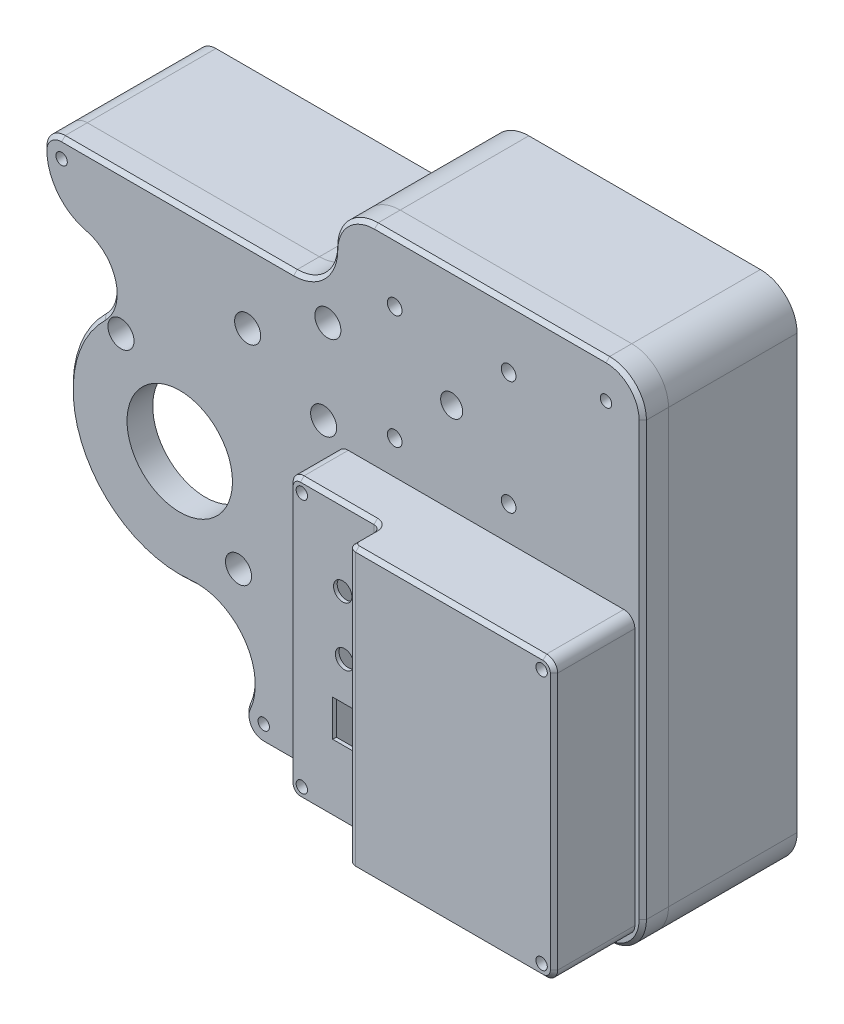
from build123d import *

# Parameters (mm, degrees)
BOSS_EXTRUDE1_DEPTH = 35
SKETCH3_R           = 2
SKETCH3_R_2         = 2.3
SKETCH3_R_3         = 14.351
SKETCH3_R_4         = 3
BOSS_EXTRUDE2_DEPTH = 7
SKETCH4_R           = 2.3
CUT_EXTRUDE1_DEPTH  = 5
SKETCH5_R           = 1.55
CUT_EXTRUDE2_DEPTH  = 7
SKETCH6_W           = 20
SKETCH6_H           = 7.7
CUT_EXTRUDE3_DEPTH  = 20
FILLET1_R           = 7
SKETCH7_W           = 7.51073917
SKETCH7_H           = 14.242062011
CUT_EXTRUDE4_DEPTH  = 155.971037617
FILLET2_R           = 2
SKETCH8_R           = 3.55
CUT_EXTRUDE5_DEPTH  = 7
SKETCH9_R           = 1.55
BOSS_EXTRUDE3_DEPTH = 12
SKETCH10_R          = 1.55
SKETCH10_R_2        = 2.5
SKETCH10_W          = 5.858621547
SKETCH10_H          = 9.950357232
BOSS_EXTRUDE4_DEPTH = 1
SKETCH11_R          = 1.55
BOSS_EXTRUDE5_DEPTH = 9
SKETCH12_R          = 1.55
BOSS_EXTRUDE6_DEPTH = 1
FILLET3_R           = 2
FILLET4_R           = 2
SKETCH13_R          = 3.55
CUT_EXTRUDE6_DEPTH  = 6.8
CHAMFER1_SIZE       = 1
CHAMFER2_SIZE       = 1


with BuildPart() as part:
    # Sketch1 → Boss-Extrude1 (new body)
    with BuildSketch(Plane.XY):
        with BuildLine():
            Line((-32.15, 57.85), (31, 57.85))
            ThreePointArc((31, 57.85), (38.778174593, 61.071825407), (42, 68.85))
            ThreePointArc((42, 68.85), (45.221825407, 76.628174593), (53, 79.85))
            Line((53, 79.85), (116, 79.85))
            ThreePointArc((116, 79.85), (123.071067812, 76.921067812), (126, 69.85))
            Line((126, 69.85), (126, -47.85))
            ThreePointArc((126, -47.85), (123.071067812, -54.921067812), (116, -57.85))
            Line((116, -57.85), (22.85, -57.85))
            ThreePointArc((22.85, -57.85), (17.85, -52.85), (22.85, -47.85))
            Line((22.85, -47.85), (106, -47.85))
            ThreePointArc((106, -47.85), (113.071067812, -44.921067812), (116, -37.85))
            Line((116, -37.85), (116, 8.15))
            ThreePointArc((116, 8.15), (113.071067812, 15.221067812), (106, 18.15))
            Line((106, 18.15), (47.85, 18.15))
            Line((47.85, 18.15), (47.85, 47.85))
            Line((47.85, 47.85), (-32.15, 47.85))
            ThreePointArc((-32.15, 47.85), (-37.15, 52.85), (-32.15, 57.85))
        make_face()
        with BuildLine():
            Line((91, 25.85), (57, 25.85))
            ThreePointArc((57, 25.85), (53.464466094, 27.314466094), (52, 30.85))
            Line((52, 30.85), (52, 64.85))
            ThreePointArc((52, 64.85), (53.464466094, 68.385533906), (57, 69.85))
            Line((57, 69.85), (91, 69.85))
            ThreePointArc((91, 69.85), (94.535533906, 68.385533906), (96, 64.85))
            Line((96, 64.85), (96, 30.85))
            ThreePointArc((96, 30.85), (94.535533906, 27.314466094), (91, 25.85))
        make_face(mode=Mode.SUBTRACT)
    extrude(amount=BOSS_EXTRUDE1_DEPTH)

    # Sketch4 → Cut-Extrude1 (cut)
    with BuildSketch(Plane.XY.offset(35)):
        with Locations((-32.15, 52.85)):
            Circle(SKETCH4_R)
        with Locations((22.85, -52.85)):
            Circle(SKETCH4_R)
        with Locations((116, 69.85)):
            Circle(SKETCH4_R)
    extrude(amount=-CUT_EXTRUDE1_DEPTH, mode=Mode.SUBTRACT)

    # Sketch6 → Cut-Extrude3 (cut)
    with BuildSketch(Plane(origin=(0, 0, 0), x_dir=(-1, 0, 0), z_dir=(0, 0, -1))):
        with Locations((-74, 22)):
            Rectangle(SKETCH6_W, SKETCH6_H)
    extrude(amount=-CUT_EXTRUDE3_DEPTH, mode=Mode.SUBTRACT)

    # Fillet1
    fillet1_edges = [part.edges().sort_by_distance(p)[0] for p in [
        (84, 22, 20),
        (64, 22, 20),
    ]]
    fillet(fillet1_edges, radius=FILLET1_R)


with BuildPart() as body_2:
    # Sketch3 → Boss-Extrude2 (new body)
    with BuildSketch(Plane.XY.offset(35)):
        with BuildLine():
            Line((22.85, -57.85), (116, -57.85))
            ThreePointArc((116, -57.85), (123.071067812, -54.921067812), (126, -47.85))
            Line((126, -47.85), (126, 69.85))
            ThreePointArc((126, 69.85), (123.071067812, 76.921067812), (116, 79.85))
            Line((116, 79.85), (53, 79.85))
            ThreePointArc((53, 79.85), (45.221825407, 76.628174593), (42, 68.85))
            ThreePointArc((42, 68.85), (38.778174593, 61.071825407), (31, 57.85))
            Line((31, 57.85), (-32.15, 57.85))
            ThreePointArc((-32.15, 57.85), (-35.685533906, 56.385533906), (-37.15, 52.85))
            ThreePointArc((-37.15, 52.85), (-33.935781924, 43.571242301), (-25.670620741, 38.269011364))
            ThreePointArc((-25.670620741, 38.269011364), (-18.378791804, 31.211325234), (-21.013275926, 21.411264205))
            ThreePointArc((-21.013275926, 21.411264205), (-27.159006896, -12.743168539), (3.036888752, -29.845892627))
            ThreePointArc((3.036888752, -29.845892627), (16.692290613, -35.954404017), (18.276333282, -50.829709735))
            ThreePointArc((18.276333282, -50.829709735), (18.660641378, -55.579335879), (22.85, -57.85))
        make_face()
        with Locations((58.5, 63.35)):
            Circle(SKETCH3_R, mode=Mode.SUBTRACT)
        with Locations((89.5, 63.35)):
            Circle(SKETCH3_R, mode=Mode.SUBTRACT)
        with Locations((89.5, 32.35)):
            Circle(SKETCH3_R, mode=Mode.SUBTRACT)
        with Locations((58.5, 32.35)):
            Circle(SKETCH3_R, mode=Mode.SUBTRACT)
        with Locations((55.85, 10.65)):
            Circle(SKETCH3_R_2, mode=Mode.SUBTRACT)
        with Locations((110.85, 10.65)):
            Circle(SKETCH3_R_2, mode=Mode.SUBTRACT)
        with Locations((55.85, -41.35)):
            Circle(SKETCH3_R_2, mode=Mode.SUBTRACT)
        with Locations((110.85, -41.35)):
            Circle(SKETCH3_R_2, mode=Mode.SUBTRACT)
        Circle(SKETCH3_R_3, mode=Mode.SUBTRACT)
        with Locations((74, 47.85)):
            Circle(SKETCH3_R_4, mode=Mode.SUBTRACT)
    extrude(amount=BOSS_EXTRUDE2_DEPTH)

    # Sketch5 → Cut-Extrude2 (cut)
    with BuildSketch(Plane.XY.offset(42)):
        with Locations((-32.15, 52.85)):
            Circle(SKETCH5_R)
        with Locations((116, 69.85)):
            Circle(SKETCH5_R)
        with Locations((22.85, -52.85)):
            Circle(SKETCH5_R)
    extrude(amount=-CUT_EXTRUDE2_DEPTH, mode=Mode.SUBTRACT)

    # Sketch7 → Cut-Extrude4 (cut, through all)
    with BuildSketch(Plane.XY.offset(42)):
        with Locations((90.865677433, -6.037329258)):
            Rectangle(SKETCH7_W, SKETCH7_H)
    extrude(amount=-CUT_EXTRUDE4_DEPTH, mode=Mode.SUBTRACT)

    # Fillet2
    fillet2_edges = [body_2.edges().sort_by_distance(p)[0] for p in [
        (87.110307848, -13.158360263, 38.5),
        (87.110307848, 1.083701748, 38.5),
        (94.621047018, 1.083701748, 38.5),
        (94.621047018, -13.158360263, 38.5),
    ]]
    fillet(fillet2_edges, radius=FILLET2_R)

    # Sketch8 → Cut-Extrude5 (cut)
    with BuildSketch(Plane.XY.offset(42)):
        with Locations((-15.994256815, 19.73179538)):
            Circle(SKETCH8_R)
        with Locations((15.994256815, -19.73179538)):
            Circle(SKETCH8_R)
    extrude(amount=-CUT_EXTRUDE5_DEPTH, mode=Mode.SUBTRACT)

    # Sketch13 → Cut-Extrude6 (cut)
    with BuildSketch(Plane.XY.offset(42)):
        with Locations((39.157611845, 26.842388155)):
            Circle(SKETCH13_R)
        with Locations((40.302896948, 50.399517056)):
            Circle(SKETCH13_R)
        with Locations((18.484531024, 38.194644733)):
            Circle(SKETCH13_R)
    extrude(amount=-CUT_EXTRUDE6_DEPTH, mode=Mode.SUBTRACT)

    # Chamfer2
    chamfer2_edges = [body_2.edges().sort_by_distance(p)[0] for p in [
        (69.425, -57.85, 42),
        (123.071067812, -54.921067812, 42),
        (126, 11, 42),
        (123.071067812, 76.921067812, 42),
        (84.5, 79.85, 42),
        (45.221825407, 76.628174593, 42),
        (38.778174593, 61.071825407, 42),
        (-0.575, 57.85, 42),
        (-35.685533906, 56.385533906, 42),
        (-33.935781924, 43.571242301, 42),
        (16.692290613, -35.954404017, 42),
        (-18.378791804, 31.211325234, 42),
        (-27.159006896, -12.743168539, 42),
        (18.660641378, -55.579335879, 42),
    ]]
    chamfer(chamfer2_edges, length=CHAMFER2_SIZE)


with BuildPart() as body_3:
    # Sketch9 → Boss-Extrude3 (new body)
    with BuildSketch(Plane.XY.offset(42)):
        with BuildLine():
            Line((45.85, 23.15), (120.85, 23.15))
            ThreePointArc((120.85, 23.15), (122.971320344, 22.271320344), (123.85, 20.15))
            Line((123.85, 20.15), (123.85, -49.85))
            ThreePointArc((123.85, -49.85), (122.971320344, -51.971320344), (120.85, -52.85))
            Line((120.85, -52.85), (45.85, -52.85))
            ThreePointArc((45.85, -52.85), (43.728679656, -51.971320344), (42.85, -49.85))
            Line((42.85, -49.85), (42.85, 20.15))
            ThreePointArc((42.85, 20.15), (43.728679656, 22.271320344), (45.85, 23.15))
        make_face()
        with Locations((46.228679656, 19.771320344)):
            Circle(SKETCH9_R, mode=Mode.SUBTRACT)
        with Locations((120.471320344, 19.771320344)):
            Circle(SKETCH9_R, mode=Mode.SUBTRACT)
        with Locations((120.471320344, -49.471320344)):
            Circle(SKETCH9_R, mode=Mode.SUBTRACT)
        with Locations((46.228679656, -49.471320344)):
            Circle(SKETCH9_R, mode=Mode.SUBTRACT)
        with BuildLine():
            Line((50.85, 18.15), (115.85, 18.15))
            ThreePointArc((115.85, 18.15), (117.971320344, 17.271320344), (118.85, 15.15))
            Line((118.85, 15.15), (118.85, -44.85))
            ThreePointArc((118.85, -44.85), (117.971320344, -46.971320344), (115.85, -47.85))
            Line((115.85, -47.85), (50.85, -47.85))
            ThreePointArc((50.85, -47.85), (48.728679656, -46.971320344), (47.85, -44.85))
            Line((47.85, -44.85), (47.85, 15.15))
            ThreePointArc((47.85, 15.15), (48.728679656, 17.271320344), (50.85, 18.15))
        make_face(mode=Mode.SUBTRACT)
    extrude(amount=BOSS_EXTRUDE3_DEPTH)

    # Sketch10 → Boss-Extrude4 (add)
    with BuildSketch(Plane.XY.offset(54)):
        with BuildLine():
            Line((42.85, 20.15), (42.85, -49.85))
            ThreePointArc((42.85, -49.85), (43.728679656, -51.971320344), (45.85, -52.85))
            Line((45.85, -52.85), (67.85, -52.85))
            Line((67.85, -52.85), (67.85, 23.15))
            Line((67.85, 23.15), (45.85, 23.15))
            ThreePointArc((45.85, 23.15), (43.728679656, 22.271320344), (42.85, 20.15))
        make_face()
        with Locations((46.228679656, 19.771320344)):
            Circle(SKETCH10_R, mode=Mode.SUBTRACT)
        with Locations((46.228679656, -49.471320344)):
            Circle(SKETCH10_R, mode=Mode.SUBTRACT)
        with Locations((57.35, 2.15)):
            Circle(SKETCH10_R_2, mode=Mode.SUBTRACT)
        with Locations((57.85, -13.58)):
            Circle(SKETCH10_R_2, mode=Mode.SUBTRACT)
        with Locations((57.553583507, -29.088114563)):
            Rectangle(SKETCH10_W, SKETCH10_H, mode=Mode.SUBTRACT)
    extrude(amount=BOSS_EXTRUDE4_DEPTH)

    # Sketch11 → Boss-Extrude5 (add)
    with BuildSketch(Plane.XY.offset(54)):
        with BuildLine():
            Line((67.85, -52.85), (67.85, 23.15))
            Line((67.85, 23.15), (120.85, 23.15))
            ThreePointArc((120.85, 23.15), (122.971320344, 22.271320344), (123.85, 20.15))
            Line((123.85, 20.15), (123.85, -49.85))
            ThreePointArc((123.85, -49.85), (122.971320344, -51.971320344), (120.85, -52.85))
            Line((120.85, -52.85), (67.85, -52.85))
        make_face()
        with Locations((120.471320344, 19.771320344)):
            Circle(SKETCH11_R, mode=Mode.SUBTRACT)
        with Locations((120.471320344, -49.471320344)):
            Circle(SKETCH11_R, mode=Mode.SUBTRACT)
        with BuildLine():
            Line((115.85, 18.15), (68.85, 18.15))
            Line((68.85, 18.15), (68.85, -47.85))
            Line((68.85, -47.85), (115.85, -47.85))
            ThreePointArc((115.85, -47.85), (117.971320344, -46.971320344), (118.85, -44.85))
            Line((118.85, -44.85), (118.85, 15.15))
            ThreePointArc((118.85, 15.15), (117.971320344, 17.271320344), (115.85, 18.15))
        make_face(mode=Mode.SUBTRACT)
    extrude(amount=BOSS_EXTRUDE5_DEPTH)

    # Sketch12 → Boss-Extrude6 (add)
    with BuildSketch(Plane.XY.offset(63)):
        with BuildLine():
            Line((67.85, -52.85), (120.85, -52.85))
            ThreePointArc((120.85, -52.85), (122.971320344, -51.971320344), (123.85, -49.85))
            Line((123.85, -49.85), (123.85, 20.15))
            ThreePointArc((123.85, 20.15), (122.971320344, 22.271320344), (120.85, 23.15))
            Line((120.85, 23.15), (67.85, 23.15))
            Line((67.85, 23.15), (67.85, -52.85))
        make_face()
        with Locations((120.471320344, 19.771320344)):
            Circle(SKETCH12_R, mode=Mode.SUBTRACT)
        with Locations((120.471320344, -49.471320344)):
            Circle(SKETCH12_R, mode=Mode.SUBTRACT)
    extrude(amount=BOSS_EXTRUDE6_DEPTH)

    # Fillet3
    fillet3_edges = [body_3.edges().sort_by_distance(p)[0] for p in [
        (67.85, -14.85, 55),
    ]]
    fillet(fillet3_edges, radius=FILLET3_R)

    # Fillet4
    fillet4_edges = [body_3.edges().sort_by_distance(p)[0] for p in [
        (67.85, -14.85, 64),
    ]]
    fillet(fillet4_edges, radius=FILLET4_R)

    # Chamfer1
    chamfer1_edges = [body_3.edges().sort_by_distance(p)[0] for p in [
        (122.971320344, -51.971320344, 64),
        (123.85, -14.85, 64),
        (122.971320344, 22.271320344, 64),
        (95.35, 23.15, 64),
        (55.85, 23.15, 55),
        (67.264213562, 23.15, 55.585786438),
        (67.264213562, -52.85, 55.585786438),
        (95.35, -52.85, 64),
        (67.85, -52.85, 59.5),
        (68.435786438, -52.85, 63.414213562),
        (67.85, 23.15, 59.5),
        (68.435786438, 23.15, 63.414213562),
        (43.728679656, 22.271320344, 55),
        (42.85, -14.85, 55),
        (43.728679656, -51.971320344, 55),
        (55.85, -52.85, 55),
    ]]
    chamfer(chamfer1_edges, length=CHAMFER1_SIZE)


solid = Compound([part.part, body_2.part, body_3.part])
